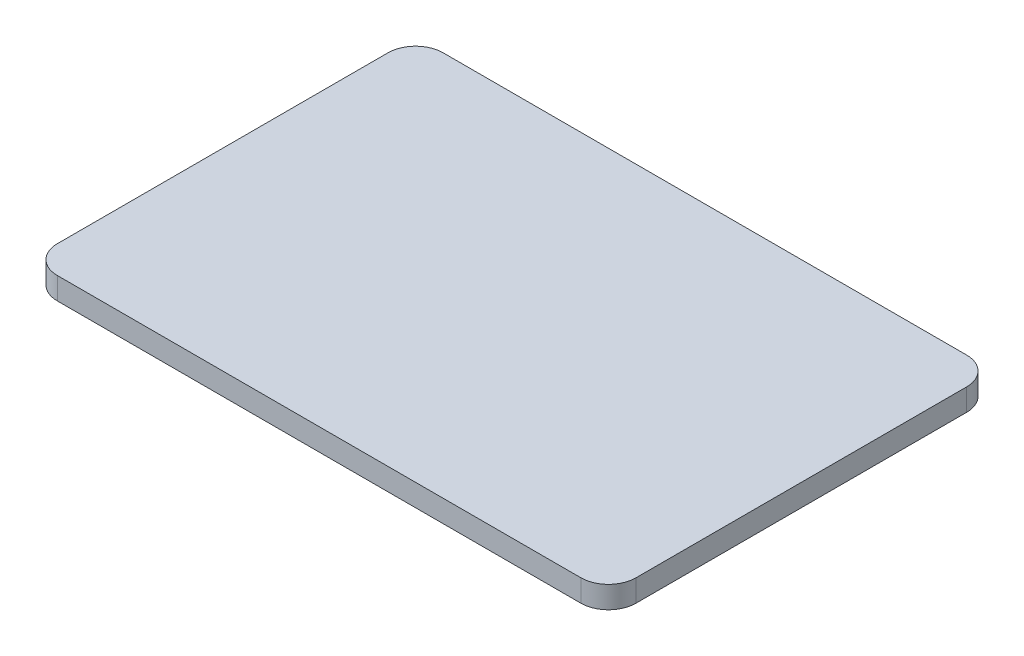
from build123d import *

# Parameters (mm, degrees)
SKETCH1_W           = 42
SKETCH1_H           = 28
BOSS_EXTRUDE1_DEPTH = 1.6
FILLET1_R           = 2


with BuildPart() as part:
    # Sketch1 → Boss-Extrude1 (new body)
    with BuildSketch(Plane(origin=(0, 0, 0), x_dir=(1, 0, 0), z_dir=(0, 1, 0))):
        with Locations((21, 14)):
            Rectangle(SKETCH1_W, SKETCH1_H)
    extrude(amount=BOSS_EXTRUDE1_DEPTH)

    # Fillet1
    fillet1_edges = [part.edges().sort_by_distance(p)[0] for p in [
        (0, 0.8, -28),
        (42, 0.8, -28),
        (42, 0.8, 0),
        (0, 0.8, 0),
    ]]
    fillet(fillet1_edges, radius=FILLET1_R)


solid = part.part
